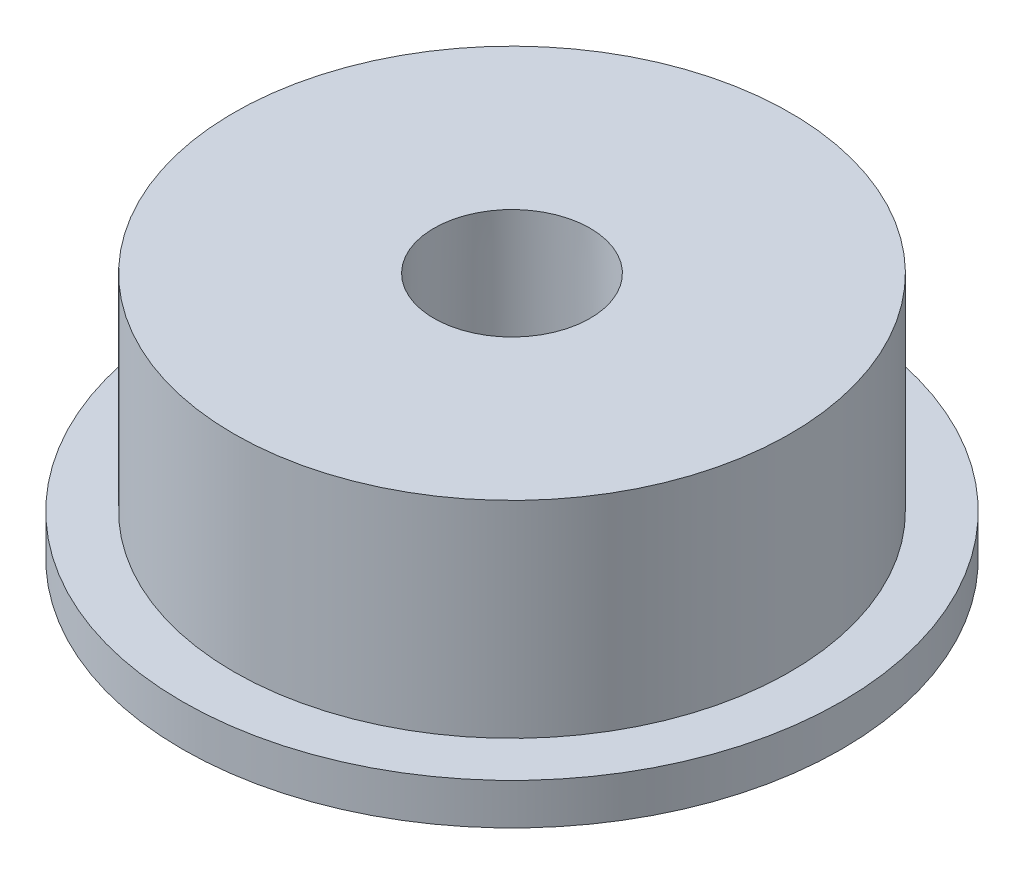
from build123d import *

# Parameters (mm, degrees)
SKETCH1_R           = 8
BOSS_EXTRUDE1_DEPTH = 1
SKETCH2_R           = 6.75
BOSS_EXTRUDE2_DEPTH = 5
SKETCH3_R           = 2
CUT_EXTRUDE1_DEPTH  = 13.806248475
CUT_EXTRUDE1_DRAFT  = -1


with BuildPart() as part:
    # Sketch1 → Boss-Extrude1 (new body)
    with BuildSketch(Plane(origin=(0, 0, 0), x_dir=(1, 0, 0), z_dir=(0, 1, 0))):
        with Locations(Location((0, 0, 0), (0, 0, 270))):
            Circle(SKETCH1_R)
    extrude(amount=BOSS_EXTRUDE1_DEPTH)

    # Sketch2 → Boss-Extrude2 (add)
    with BuildSketch(Plane(origin=(0, 1, 0), x_dir=(1, 0, 0), z_dir=(0, 1, 0))):
        with Locations(Location((0, 0, 0), (0, 0, 270))):
            Circle(SKETCH2_R)
    extrude(amount=BOSS_EXTRUDE2_DEPTH)


with BuildPart() as cut_extrude1_tool:
    # Sketch3 → Cut-Extrude1 (with draft: the straight prism first)
    with BuildSketch(Plane.XZ):
        Circle(SKETCH3_R)
    extrude(amount=-CUT_EXTRUDE1_DEPTH)
    # Cut-Extrude1: the draft: its side faces are tilted about the plane it starts from
    cut_extrude1_sides = [cut_extrude1_tool.faces().sort_by_distance(p)[0] for p in [
        (-2, 6.903124237, 0),
    ]]
    draft(cut_extrude1_sides, Plane.XZ, CUT_EXTRUDE1_DRAFT)


with BuildPart() as part_1:
    add(part.part)

    # Cut-Extrude1: cut by cut_extrude1_tool
    add(cut_extrude1_tool.part, mode=Mode.SUBTRACT)


solid = part_1.part
